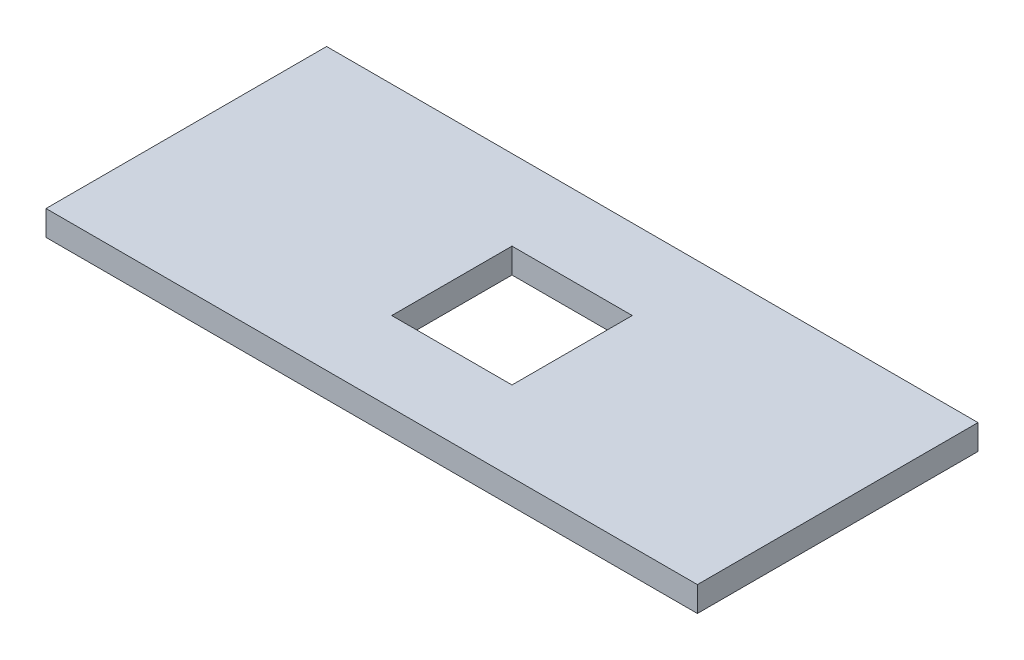
from build123d import *

# Parameters (mm, degrees)
IZIM1_W                     = 130
IZIM1_H                     = 56
IZIM1_W_2                   = 24
IZIM1_H_2                   = 24
Y_KSEKLIK_EKSTR_ZYON1_DEPTH = 5


with BuildPart() as part:
    # Çizim1 → Yükseklik-Ekstrüzyon1 (new body)
    with BuildSketch(Plane(origin=(0, 0, 0), x_dir=(1, 0, 0), z_dir=(0, 1, 0))):
        Rectangle(IZIM1_W, IZIM1_H)
        Rectangle(IZIM1_W_2, IZIM1_H_2, mode=Mode.SUBTRACT)
    extrude(amount=Y_KSEKLIK_EKSTR_ZYON1_DEPTH)


solid = part.part
